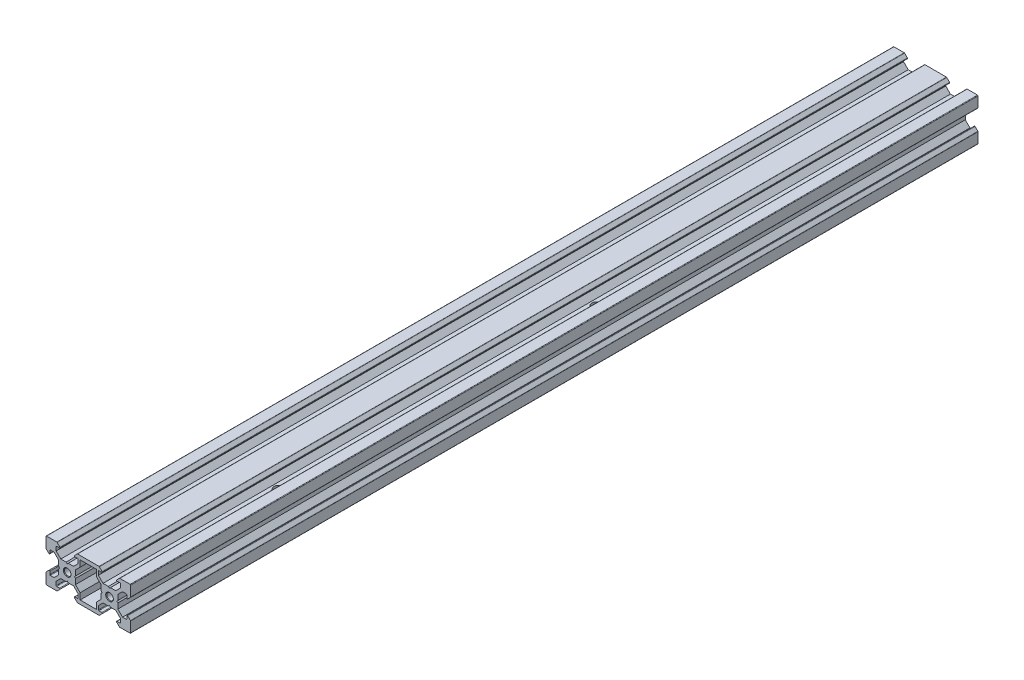
from build123d import *

# Parameters (mm, degrees)
SALIENTE_EXTRUIR1_DEPTH      = 200
SALIENTE_EXTRUIR1_DEPTH_BACK = 200
CROQUIS4_R                   = 1.569264143
CORTAR_EXTRUIR1_DEPTH        = 402.248052955
CHAFL_N1_SIZE                = 0.25
CROQUIS9_R                   = 2.25
CORTAR_EXTRUIR2_DEPTH        = 204.224014329


with BuildPart() as part:
    # Croquis1 → Saliente-Extruir1 (new, two sides: drawn at the far end of the back side and taken through both)
    with BuildSketch(Plane.XY.offset(-SALIENTE_EXTRUIR1_DEPTH_BACK)):
        with BuildLine():
            Line((-3.509619408, 8.626776695), (-4.809619408, 9.926776695))
            ThreePointArc((-4.809619408, 9.926776695), (-4.890725245, 9.980969883), (-4.986396103, 10))
            Line((-4.986396103, 10), (-15.096446609, 10))
            ThreePointArc((-15.096446609, 10), (-15.192117467, 9.980969883), (-15.273223305, 9.926776695))
            Line((-15.273223305, 9.926776695), (-16.573223305, 8.626776695))
            ThreePointArc((-16.573223305, 8.626776695), (-16.627416493, 8.354329142), (-16.396446609, 8.2))
            Line((-16.396446609, 8.2), (-15.039949494, 8.2))
            ThreePointArc((-15.039949494, 8.2), (-14.863172798, 8.126776695), (-14.789949494, 7.95))
            Line((-14.789949494, 7.95), (-14.789949494, 6.2))
            Line((-14.789949494, 6.2), (-16.989949494, 4))
            Line((-16.989949494, 4), (-19.5, 4))
            Line((-19.5, 4), (-20, 3.5))
            Line((-20, 3.5), (-20.5, 4))
            Line((-20.5, 4), (-23.010050506, 4))
            Line((-23.010050506, 4), (-25.210050506, 6.2))
            Line((-25.210050506, 6.2), (-25.210050506, 7.95))
            ThreePointArc((-25.210050506, 7.95), (-25.136827202, 8.126776695), (-24.960050506, 8.2))
            Line((-24.960050506, 8.2), (-23.603553391, 8.2))
            ThreePointArc((-23.603553391, 8.2), (-23.372583507, 8.354329142), (-23.426776695, 8.626776695))
            Line((-23.426776695, 8.626776695), (-24.726776695, 9.926776695))
            ThreePointArc((-24.726776695, 9.926776695), (-24.807882533, 9.980969883), (-24.903553391, 10))
            Line((-24.903553391, 10), (-29.75, 10))
            ThreePointArc((-29.75, 10), (-29.926776695, 9.926776695), (-30, 9.75))
            Line((-30, 9.75), (-30, 4.903553391))
            ThreePointArc((-30, 4.903553391), (-29.980969883, 4.807882533), (-29.926776695, 4.726776695))
            Line((-29.926776695, 4.726776695), (-28.626776695, 3.426776695))
            ThreePointArc((-28.626776695, 3.426776695), (-28.354329142, 3.372583507), (-28.2, 3.603553391))
            Line((-28.2, 3.603553391), (-28.2, 4.960050506))
            ThreePointArc((-28.2, 4.960050506), (-28.126776695, 5.136827202), (-27.95, 5.210050506))
            Line((-27.95, 5.210050506), (-26.2, 5.210050506))
            Line((-26.2, 5.210050506), (-24, 3.010050506))
            Line((-24, 3.010050506), (-24, 0.5))
            Line((-24, 0.5), (-23.5, 0))
            Line((-23.5, 0), (-24, -0.5))
            Line((-24, -0.5), (-24, -3.010050506))
            Line((-24, -3.010050506), (-26.2, -5.210050506))
            Line((-26.2, -5.210050506), (-27.95, -5.210050506))
            ThreePointArc((-27.95, -5.210050506), (-28.126776695, -5.136827202), (-28.2, -4.960050506))
            Line((-28.2, -4.960050506), (-28.2, -3.603553391))
            ThreePointArc((-28.2, -3.603553391), (-28.354329142, -3.372583507), (-28.626776695, -3.426776695))
            Line((-28.626776695, -3.426776695), (-29.926776695, -4.726776695))
            ThreePointArc((-29.926776695, -4.726776695), (-29.980969883, -4.807882533), (-30, -4.903553391))
            Line((-30, -4.903553391), (-30, -9.75))
            ThreePointArc((-30, -9.75), (-29.926776695, -9.926776695), (-29.75, -10))
            Line((-29.75, -10), (-24.903553391, -10))
            ThreePointArc((-24.903553391, -10), (-24.807882533, -9.980969883), (-24.726776695, -9.926776695))
            Line((-24.726776695, -9.926776695), (-23.426776695, -8.626776695))
            ThreePointArc((-23.426776695, -8.626776695), (-23.372583507, -8.354329142), (-23.603553391, -8.2))
            Line((-23.603553391, -8.2), (-24.960050506, -8.2))
            ThreePointArc((-24.960050506, -8.2), (-25.136827202, -8.126776695), (-25.210050506, -7.95))
            Line((-25.210050506, -7.95), (-25.210050506, -6.2))
            Line((-25.210050506, -6.2), (-23.010050506, -4))
            Line((-23.010050506, -4), (-20.5, -4))
            Line((-20.5, -4), (-20, -3.5))
            Line((-20, -3.5), (-19.5, -4))
            Line((-19.5, -4), (-16.989949494, -4))
            Line((-16.989949494, -4), (-14.789949494, -6.2))
            Line((-14.789949494, -6.2), (-14.789949494, -7.95))
            ThreePointArc((-14.789949494, -7.95), (-14.863172798, -8.126776695), (-15.039949494, -8.2))
            Line((-15.039949494, -8.2), (-16.396446609, -8.2))
            ThreePointArc((-16.396446609, -8.2), (-16.627416493, -8.354329142), (-16.573223305, -8.626776695))
            Line((-16.573223305, -8.626776695), (-15.273223305, -9.926776695))
            ThreePointArc((-15.273223305, -9.926776695), (-15.192117467, -9.980969883), (-15.096446609, -10))
            Line((-15.096446609, -10), (-4.986396103, -10))
            ThreePointArc((-4.986396103, -10), (-4.890725245, -9.980969883), (-4.809619408, -9.926776695))
            Line((-4.809619408, -9.926776695), (-3.509619408, -8.626776695))
            ThreePointArc((-3.509619408, -8.626776695), (-3.45542622, -8.354329142), (-3.686396103, -8.2))
            Line((-3.686396103, -8.2), (-5.042893219, -8.2))
            ThreePointArc((-5.042893219, -8.2), (-5.219669914, -8.126776695), (-5.292893219, -7.95))
            Line((-5.292893219, -7.95), (-5.292893219, -6.2))
            Line((-5.292893219, -6.2), (-3.092893219, -4))
            Line((-3.092893219, -4), (-0.582842712, -4))
            Line((-0.582842712, -4), (-0.082842712, -3.5))
            Line((-0.082842712, -3.5), (0.417157288, -4))
            Line((0.417157288, -4), (2.927207794, -4))
            Line((2.927207794, -4), (5.127207794, -6.2))
            Line((5.127207794, -6.2), (5.127207794, -7.95))
            ThreePointArc((5.127207794, -7.95), (5.053984489, -8.126776695), (4.877207794, -8.2))
            Line((4.877207794, -8.2), (3.520710678, -8.2))
            ThreePointArc((3.520710678, -8.2), (3.289740795, -8.354329142), (3.343933983, -8.626776695))
            Line((3.343933983, -8.626776695), (4.643933983, -9.926776695))
            ThreePointArc((4.643933983, -9.926776695), (4.72503982, -9.980969883), (4.820710678, -10))
            Line((4.820710678, -10), (9.667157288, -10))
            ThreePointArc((9.667157288, -10), (9.843933983, -9.926776695), (9.917157288, -9.75))
            Line((9.917157288, -9.75), (9.917157288, -4.903553391))
            ThreePointArc((9.917157288, -4.903553391), (9.898127171, -4.807882533), (9.843933983, -4.726776695))
            Line((9.843933983, -4.726776695), (8.543933983, -3.426776695))
            ThreePointArc((8.543933983, -3.426776695), (8.271486429, -3.372583507), (8.117157288, -3.603553391))
            Line((8.117157288, -3.603553391), (8.117157288, -4.960050506))
            ThreePointArc((8.117157288, -4.960050506), (8.043933983, -5.136827202), (7.867157288, -5.210050506))
            Line((7.867157288, -5.210050506), (6.117157288, -5.210050506))
            Line((6.117157288, -5.210050506), (3.917157288, -3.010050506))
            Line((3.917157288, -3.010050506), (3.917157288, -0.5))
            Line((3.917157288, -0.5), (3.417157288, 0))
            Line((3.417157288, 0), (3.917157288, 0.5))
            Line((3.917157288, 0.5), (3.917157288, 3.010050506))
            Line((3.917157288, 3.010050506), (6.117157288, 5.210050506))
            Line((6.117157288, 5.210050506), (7.867157288, 5.210050506))
            ThreePointArc((7.867157288, 5.210050506), (8.043933983, 5.136827202), (8.117157288, 4.960050506))
            Line((8.117157288, 4.960050506), (8.117157288, 3.603553391))
            ThreePointArc((8.117157288, 3.603553391), (8.271486429, 3.372583507), (8.543933983, 3.426776695))
            Line((8.543933983, 3.426776695), (9.843933983, 4.726776695))
            ThreePointArc((9.843933983, 4.726776695), (9.898127171, 4.807882533), (9.917157288, 4.903553391))
            Line((9.917157288, 4.903553391), (9.917157288, 9.75))
            ThreePointArc((9.917157288, 9.75), (9.843933983, 9.926776695), (9.667157288, 10))
            Line((9.667157288, 10), (4.820710678, 10))
            ThreePointArc((4.820710678, 10), (4.72503982, 9.980969883), (4.643933983, 9.926776695))
            Line((4.643933983, 9.926776695), (3.343933983, 8.626776695))
            ThreePointArc((3.343933983, 8.626776695), (3.289740795, 8.354329142), (3.520710678, 8.2))
            Line((3.520710678, 8.2), (4.877207794, 8.2))
            ThreePointArc((4.877207794, 8.2), (5.053984489, 8.126776695), (5.127207794, 7.95))
            Line((5.127207794, 7.95), (5.127207794, 6.2))
            Line((5.127207794, 6.2), (2.927207794, 4))
            Line((2.927207794, 4), (0.417157288, 4))
            Line((0.417157288, 4), (-0.082842712, 3.5))
            Line((-0.082842712, 3.5), (-0.582842712, 4))
            Line((-0.582842712, 4), (-3.092893219, 4))
            Line((-3.092893219, 4), (-5.292893219, 6.2))
            Line((-5.292893219, 6.2), (-5.292893219, 7.95))
            ThreePointArc((-5.292893219, 7.95), (-5.219669914, 8.126776695), (-5.042893219, 8.2))
            Line((-5.042893219, 8.2), (-3.686396103, 8.2))
            ThreePointArc((-3.686396103, 8.2), (-3.45542622, 8.354329142), (-3.509619408, 8.626776695))
        make_face()
        Polygon((-13.882842712, 5.210050506), (-13.882842712, 8.2), (-6.2, 8.2), (-6.2, 5.210050506), (-4, 3.010050506), (-4, 0.5), (-3.5, 0), (-4, -0.5), (-4, -3.010050506), (-6.2, -5.210050506), (-6.2, -8.2), (-13.882842712, -8.2), (-13.882842712, -5.210050506), (-16.082842712, -3.010050506), (-16.082842712, -0.5), (-16.582842712, 0), (-16.082842712, 0.5), (-16.082842712, 3.010050506), align=None, mode=Mode.SUBTRACT)
    extrude(amount=SALIENTE_EXTRUIR1_DEPTH + SALIENTE_EXTRUIR1_DEPTH_BACK)

    # Croquis4 → Cortar-Extruir1 (cut, through all)
    with BuildSketch(Plane.XY.offset(200)):
        with Locations((-20, 0)):
            Circle(CROQUIS4_R)
        Circle(CROQUIS4_R)
    extrude(amount=-CORTAR_EXTRUIR1_DEPTH, mode=Mode.SUBTRACT)

    # Chaflán1
    chafl_n1_edges = [part.edges().sort_by_distance(p)[0] for p in [
        (-21.569264143, 0, -200),
        (-1.569264143, 0, -200),
        (-1.569264143, 0, 200),
        (-21.569264143, 0, 200),
    ]]
    chamfer(chafl_n1_edges, length=CHAFL_N1_SIZE)

    # Croquis9 → Cortar-Extruir2 (cut, through all)
    with BuildSketch(Plane(origin=(0, 10, 0), x_dir=(1, 0, 0), z_dir=(0, 1, 0))):
        with Locations((-0.082842712, -120)):
            Circle(CROQUIS9_R)
        with Locations((-0.082842712, 30)):
            Circle(CROQUIS9_R)
    extrude(amount=-CORTAR_EXTRUIR2_DEPTH, mode=Mode.SUBTRACT)


solid = part.part
